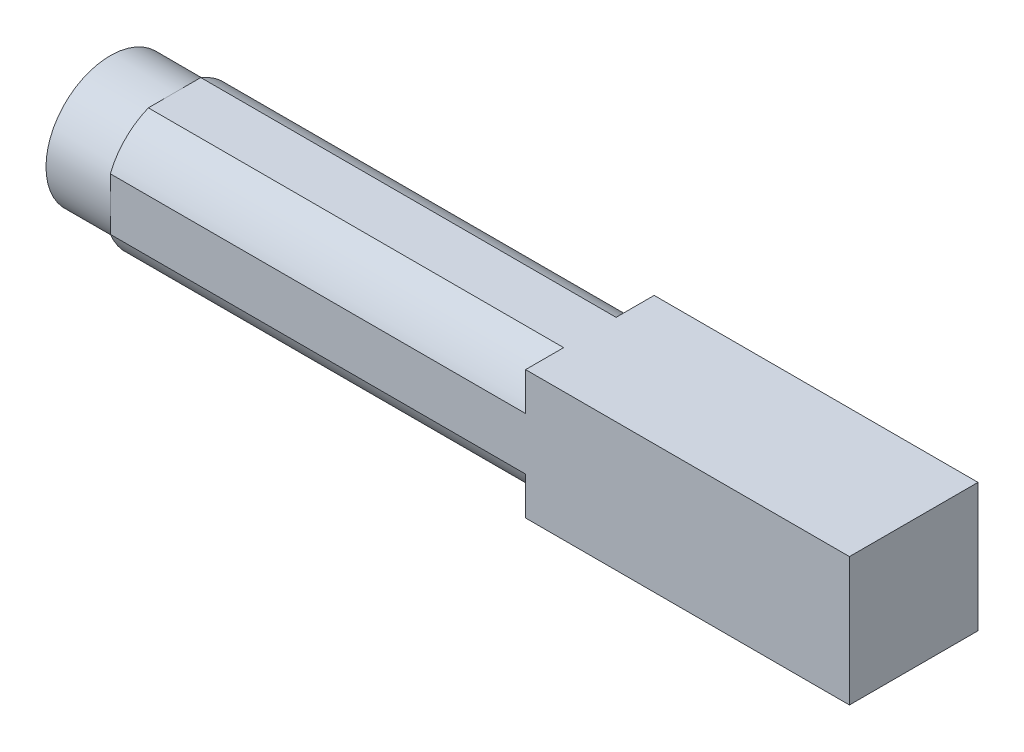
from build123d import *

# Parameters (mm, degrees)
SKETCH1_W           = 6.35
SKETCH1_H           = 6.35
BOSS_EXTRUDE1_DEPTH = 39.6875
SKETCH4_W           = 11.064537346
SKETCH4_H           = 8.106256658
SKETCH4_R           = 3.175
CUT_EXTRUDE3_DEPTH  = 3.175
CUT_EXTRUDE4_START  = -20.515625
SKETCH5_W           = 9.216364604
SKETCH5_H           = 9.38217528
SKETCH5_R           = 3.429
CUT_EXTRUDE4_DEPTH  = 20.515625


with BuildPart() as part:
    # Sketch1 → Boss-Extrude1 (new body)
    with BuildSketch(Plane(origin=(0, 0, 0), x_dir=(0, 0, -1), z_dir=(1, 0, 0))):
        Rectangle(SKETCH1_W, SKETCH1_H)
    extrude(amount=BOSS_EXTRUDE1_DEPTH)

    # Sketch4 → Cut-Extrude3 (cut)
    with BuildSketch(Plane.ZY):
        Rectangle(SKETCH4_W, SKETCH4_H)
        Circle(SKETCH4_R, mode=Mode.SUBTRACT)
    extrude(amount=-CUT_EXTRUDE3_DEPTH, mode=Mode.SUBTRACT)

    # Sketch5 → Cut-Extrude4 (cut)
    with BuildSketch(Plane.ZY.offset(-3.175).offset(CUT_EXTRUDE4_START)):
        Rectangle(SKETCH5_W, SKETCH5_H)
        Circle(SKETCH5_R, mode=Mode.SUBTRACT)
    extrude(amount=CUT_EXTRUDE4_DEPTH, mode=Mode.SUBTRACT)


solid = part.part
